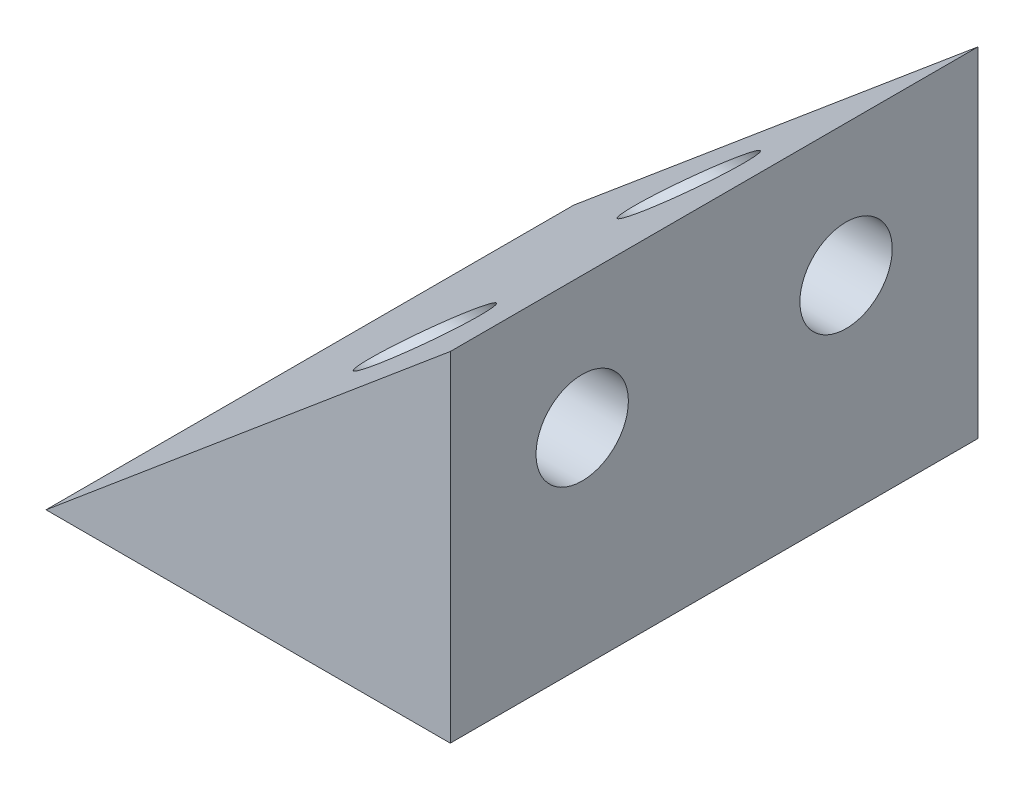
from build123d import *

# Parameters (mm, degrees)
BOSS_EXTRUDE1_DEPTH = 20
CUT_EXTRUDE1_REACH  = 30.284
SKETCH3_R           = 1.75
CUT_EXTRUDE2_DEPTH  = 1


with BuildPart() as part:
    # Sketch1 → Boss-Extrude1 (new body)
    with BuildSketch(Plane.XY):
        Polygon((0, 0), (-15.320888862, 0), (0, 12.855752194), align=None)
    extrude(amount=BOSS_EXTRUDE1_DEPTH)

    # Cut-Extrude1: up to this plane
    cut_extrude1_end = Plane(origin=(-15.320888862, 0, 20), z_dir=(0.6427876096865347, -0.7660444431189819, 0))
    # Sketch3 → Cut-Extrude1 (cut, up to the surface)
    with BuildSketch(Plane(origin=(0, 0, 0), x_dir=(0, 0, -1), z_dir=(1, 0, 0)), mode=Mode.PRIVATE) as cut_extrude1_sk1:
        with Locations(Location((-5, 7.855752194, 0), (0, 0, 90))):
            Circle(SKETCH3_R)
    cut_extrude1_tool1 = split(extrude(cut_extrude1_sk1.sketch, amount=-CUT_EXTRUDE1_REACH, mode=Mode.PRIVATE), bisect_by=cut_extrude1_end, keep=Keep.BOTH, mode=Mode.PRIVATE)
    add(cut_extrude1_tool1.solids().sort_by_distance((0, 7.855752, 5))[0], mode=Mode.SUBTRACT)
    # Sketch3 → Cut-Extrude1 (cut, up to the surface)
    with BuildSketch(Plane(origin=(0, 0, 0), x_dir=(0, 0, -1), z_dir=(1, 0, 0)), mode=Mode.PRIVATE) as cut_extrude1_sk2:
        with Locations(Location((-15, 7.855752194, 0), (0, 0, 90))):
            Circle(SKETCH3_R)
    cut_extrude1_tool2 = split(extrude(cut_extrude1_sk2.sketch, amount=-CUT_EXTRUDE1_REACH, mode=Mode.PRIVATE), bisect_by=cut_extrude1_end, keep=Keep.BOTH, mode=Mode.PRIVATE)
    add(cut_extrude1_tool2.solids().sort_by_distance((0, 7.855752, 15))[0], mode=Mode.SUBTRACT)

    # Sketch4 → Cut-Extrude2 (cut)
    # profile 1 of 2: a face of its own
    with BuildSketch(Plane.XZ):
        with BuildLine():
            add(Edge.make_bspline(
                [(-5.911846675, 9.865384615), (-5.855749287, 9.865056597), (-5.746779303, 9.864419417), (-5.587994661, 9.857330996), (-5.439034371, 9.845555655), (-5.299891307, 9.829418279), (-5.170529535, 9.809780308), (-5.051294804, 9.783564792), (-4.941635109, 9.753752086), (-4.841193358, 9.719199315), (-4.748614631, 9.680212646), (-4.662193041, 9.637774437), (-4.582038305, 9.590223642), (-4.506946286, 9.540196681), (-4.437755047, 9.485865435), (-4.374595619, 9.427802965), (-4.317429865, 9.365433315), (-4.265577415, 9.299990015), (-4.220407322, 9.231059481), (-4.179706065, 9.160766611), (-4.146300055, 9.087871031), (-4.118851035, 9.013037572), (-4.096856831, 8.936483858), (-4.081625887, 8.857893574), (-4.07208018, 8.777247733), (-4.071164983, 8.72281691), (-4.070700841, 8.69521234)],
                knots=[0, 0, 0, 0, 1.646377244, 3.198111528, 4.663803227, 6.031090796, 7.308794487, 8.502186765, 9.612154809, 10.642545331, 11.617106989, 12.558866172, 13.465886467, 14.35053239, 15.20542558, 16.045215227, 16.865619885, 17.686225247, 18.492864914, 19.282407821, 20.068097601, 20.842842034, 21.620163247, 22.403093475, 23.190129512, 24, 24, 24, 24], degree=3))
            add(Edge.make_bspline(
                [(-4.070700841, 8.69521234), (-4.071188657, 8.667376861), (-4.072158768, 8.612020852), (-4.08148271, 8.530180477), (-4.096953833, 8.450230795), (-4.118874808, 8.372512657), (-4.146070484, 8.29638767), (-4.180157602, 8.222451263), (-4.219836469, 8.150244181), (-4.266460346, 8.080913893), (-4.318442622, 8.013699278), (-4.377205291, 7.950251315), (-4.44215501, 7.890564229), (-4.512596874, 7.833888924), (-4.589881959, 7.781833327), (-4.672666069, 7.732259894), (-4.762396934, 7.687887858), (-4.857577402, 7.645153183), (-4.96084106, 7.608266197), (-5.071605821, 7.574999951), (-5.191180008, 7.548120983), (-5.318936253, 7.52573171), (-5.455343736, 7.508386814), (-5.600110052, 7.495754172), (-5.753330442, 7.489081087), (-5.858088292, 7.487824386), (-5.911846675, 7.487179487)],
                knots=[0, 0, 0, 0, 0.810914788, 1.612654377, 2.396697861, 3.181598691, 3.963628158, 4.749916497, 5.551656086, 6.361998678, 7.18212741, 8.025565596, 8.878627764, 9.750805457, 10.657531673, 11.591944965, 12.560506719, 13.57287815, 14.630710178, 15.753379473, 16.941251878, 18.199788006, 19.531962791, 20.947069417, 22.433333509, 24, 24, 24, 24], degree=3))
            add(Edge.make_bspline(
                [(-5.911846675, 7.487179487), (-5.965370383, 7.487831877), (-6.069659145, 7.489103032), (-6.222192885, 7.495670613), (-6.366181214, 7.508668333), (-6.502024942, 7.524744462), (-6.628917519, 7.547644686), (-6.748065541, 7.573678205), (-6.85844078, 7.606035075), (-6.961159835, 7.64241929), (-7.05587398, 7.684226665), (-7.144829164, 7.728990868), (-7.227545725, 7.778260008), (-7.304829686, 7.830626053), (-7.375882464, 7.886819625), (-7.440879663, 7.946759451), (-7.499778411, 8.010491153), (-7.552470928, 8.077857734), (-7.598552071, 8.148278684), (-7.6397412, 8.220244748), (-7.673163625, 8.295192302), (-7.701382826, 8.371455698), (-7.723354231, 8.449754531), (-7.738397903, 8.530012), (-7.748977846, 8.611965265), (-7.749783232, 8.667367231), (-7.750188021, 8.69521234)],
                knots=[0, 0, 0, 0, 1.56130642, 3.042141888, 4.451772327, 5.777565838, 7.030558081, 8.211376819, 9.333164717, 10.383253789, 11.387583522, 12.350962576, 13.286244149, 14.193812918, 15.072134482, 15.925989337, 16.770211267, 17.600669898, 18.417446232, 19.22325363, 20.01647746, 20.807971184, 21.593601364, 22.38506573, 23.188331689, 24, 24, 24, 24], degree=3))
            add(Edge.make_bspline(
                [(-7.750188021, 8.69521234), (-7.749719413, 8.722815788), (-7.748795409, 8.777244401), (-7.739314215, 8.857906439), (-7.723853582, 8.936374154), (-7.702858119, 9.012804408), (-7.67617413, 9.087353616), (-7.642233085, 9.159291496), (-7.602866753, 9.2295681), (-7.558080183, 9.297862753), (-7.50675594, 9.3628738), (-7.449992852, 9.424973717), (-7.386367185, 9.482594504), (-7.316897365, 9.536244807), (-7.242172844, 9.58715603), (-7.161457528, 9.634240862), (-7.074226219, 9.676596293), (-6.981136428, 9.716456686), (-6.87995648, 9.751593547), (-6.769711906, 9.782396514), (-6.649792857, 9.808075096), (-6.520555338, 9.828725945), (-6.38190262, 9.845750492), (-6.233590578, 9.857275238), (-6.075747171, 9.864425062), (-5.967477141, 9.865058928), (-5.911846675, 9.865384615)],
                knots=[0, 0, 0, 0, 0.810940842, 1.599017053, 2.38298203, 3.159479784, 3.926441347, 4.70693857, 5.494146311, 6.292334103, 7.104379492, 7.925868426, 8.762126819, 9.623561095, 10.503686106, 11.41783325, 12.366995289, 13.351843594, 14.392337808, 15.512229747, 16.713911458, 17.994391108, 19.357476964, 20.818259213, 22.365182633, 24, 24, 24, 24], degree=3))
        make_face()
        with BuildLine():
            add(Edge.make_bspline(
                [(-5.910444431, 9.551282051), (-5.95719313, 9.551162604), (-6.047923175, 9.550930781), (-6.179766436, 9.54487458), (-6.302736765, 9.536624349), (-6.416990299, 9.525983049), (-6.52214032, 9.51018011), (-6.618909975, 9.492473291), (-6.706787304, 9.470925304), (-6.786374812, 9.445429949), (-6.859024912, 9.416392001), (-6.926622524, 9.384682123), (-6.989987212, 9.350635607), (-7.048475401, 9.312465852), (-7.102669298, 9.271038631), (-7.152413166, 9.226285917), (-7.19748996, 9.178286418), (-7.250977945, 9.111839375), (-7.306904454, 9.024548906), (-7.355005521, 8.914002071), (-7.3854296, 8.800360685), (-7.389287877, 8.723205872), (-7.391213662, 8.684695513)],
                knots=[0, 0, 0, 0, 1.459116078, 2.831857795, 4.118796693, 5.306371758, 6.412361096, 7.436813035, 8.376339383, 9.234574298, 10.043323891, 10.816788787, 11.564361537, 12.286735248, 12.994408768, 13.691741332, 14.372975427, 15.047457468, 16.352811911, 17.594285292, 18.799233213, 20, 20, 20, 20], degree=3))
            add(Edge.make_bspline(
                [(-7.391213662, 8.684695513), (-7.389615881, 8.645937841), (-7.386423618, 8.568502518), (-7.355624881, 8.455368723), (-7.309155342, 8.345538453), (-7.254207836, 8.259466512), (-7.201879507, 8.193983969), (-7.157264858, 8.147066979), (-7.107308991, 8.10400493), (-7.053409695, 8.063162856), (-6.994537211, 8.02570378), (-6.930974636, 7.991640642), (-6.862545458, 7.960557295), (-6.814775719, 7.942848249), (-6.790352284, 7.933794071)],
                knots=[0, 0, 0, 0, 1.353760809, 2.704726607, 4.075137775, 5.516104923, 6.260822281, 7.007110065, 7.778089737, 8.566572457, 9.372053459, 10.217411131, 11.088608312, 12, 12, 12, 12], degree=3))
            add(Edge.make_bspline(
                [(-6.790352284, 7.933794071), (-6.759122544, 7.923242303), (-6.69571278, 7.901817689), (-6.597349128, 7.874205915), (-6.494146364, 7.852460515), (-6.386721247, 7.83289715), (-6.274281546, 7.819544094), (-6.157175162, 7.80879628), (-6.0353138, 7.802465594), (-5.952518809, 7.801680842), (-5.910444431, 7.801282051)],
                knots=[0, 0, 0, 0, 0.884706709, 1.796334032, 2.740027952, 3.714592787, 4.726048262, 5.777819803, 6.87074269, 8, 8, 8, 8], degree=3))
            add(Edge.make_bspline(
                [(-5.910444431, 7.801282051), (-5.868370958, 7.801721875), (-5.786056068, 7.802582372), (-5.665629311, 7.80823591), (-5.551049969, 7.817320676), (-5.4422141, 7.829616707), (-5.339315419, 7.846496558), (-5.242206679, 7.866767579), (-5.150914061, 7.890533025), (-5.065202128, 7.9177927), (-4.985378952, 7.948513976), (-4.911270741, 7.982451775), (-4.842484619, 8.018668005), (-4.779218028, 8.058011632), (-4.721185397, 8.100006966), (-4.669550825, 8.145764604), (-4.622713851, 8.193468954), (-4.569251284, 8.260286147), (-4.514739588, 8.347760433), (-4.464573828, 8.456606082), (-4.435765535, 8.569876726), (-4.431703848, 8.64645018), (-4.4296752, 8.684695513)],
                knots=[0, 0, 0, 0, 1.313668642, 2.570134578, 3.763346207, 4.902004944, 5.98888779, 7.017888835, 7.998425394, 8.933058446, 9.82474457, 10.667209444, 11.476765193, 12.250262638, 12.991704352, 13.7104269, 14.401925311, 15.076585796, 16.378385137, 17.609787933, 18.806186071, 20, 20, 20, 20], degree=3))
            add(Edge.make_bspline(
                [(-4.4296752, 8.684695513), (-4.43170403, 8.72340773), (-4.435765385, 8.80090269), (-4.464498285, 8.915326021), (-4.514272533, 9.024947029), (-4.569603302, 9.111719517), (-4.621767413, 9.178452408), (-4.667129522, 9.225575145), (-4.717023873, 9.269629998), (-4.770988327, 9.311091733), (-4.829506015, 9.349224743), (-4.892861488, 9.383285193), (-4.960465382, 9.414976868), (-5.033098953, 9.444077159), (-5.112806444, 9.469336238), (-5.200240265, 9.491913196), (-5.297100307, 9.509609273), (-5.402544299, 9.525051618), (-5.516938287, 9.536825531), (-5.640192121, 9.544853401), (-5.77226338, 9.550941739), (-5.863461555, 9.551166342), (-5.910444431, 9.551282051)],
                knots=[0, 0, 0, 0, 1.207964612, 2.418129846, 3.655795183, 4.951004962, 5.620895151, 6.296795572, 6.989224116, 7.696855977, 8.419187164, 9.166715907, 9.940135271, 10.748837255, 11.607021648, 12.548275234, 13.5654991, 14.678641405, 15.874140913, 17.15372626, 18.533675393, 20, 20, 20, 20], degree=3))
        make_face(mode=Mode.SUBTRACT)
    # profile 2 of 2: a face of its own
    with BuildSketch(Plane.XZ):
        Polygon((-4.070700841, 10.647135417), (-4.070700841, 10.583333333), (-6.493777765, 10.583333333), (-6.493777765, 10.179487179), (-6.852752123, 10.179487179), (-6.852752123, 10.583333333), (-7.660444431, 10.583333333), (-7.660444431, 10.897435897), (-6.852752123, 10.897435897), (-6.852752123, 12.557692308), align=None)
        Polygon((-6.493777765, 10.897435897), (-4.973745713, 10.897435897), (-6.493777765, 11.940705128), align=None, mode=Mode.SUBTRACT)
    extrude(amount=-CUT_EXTRUDE2_DEPTH, mode=Mode.SUBTRACT)


solid = part.part
